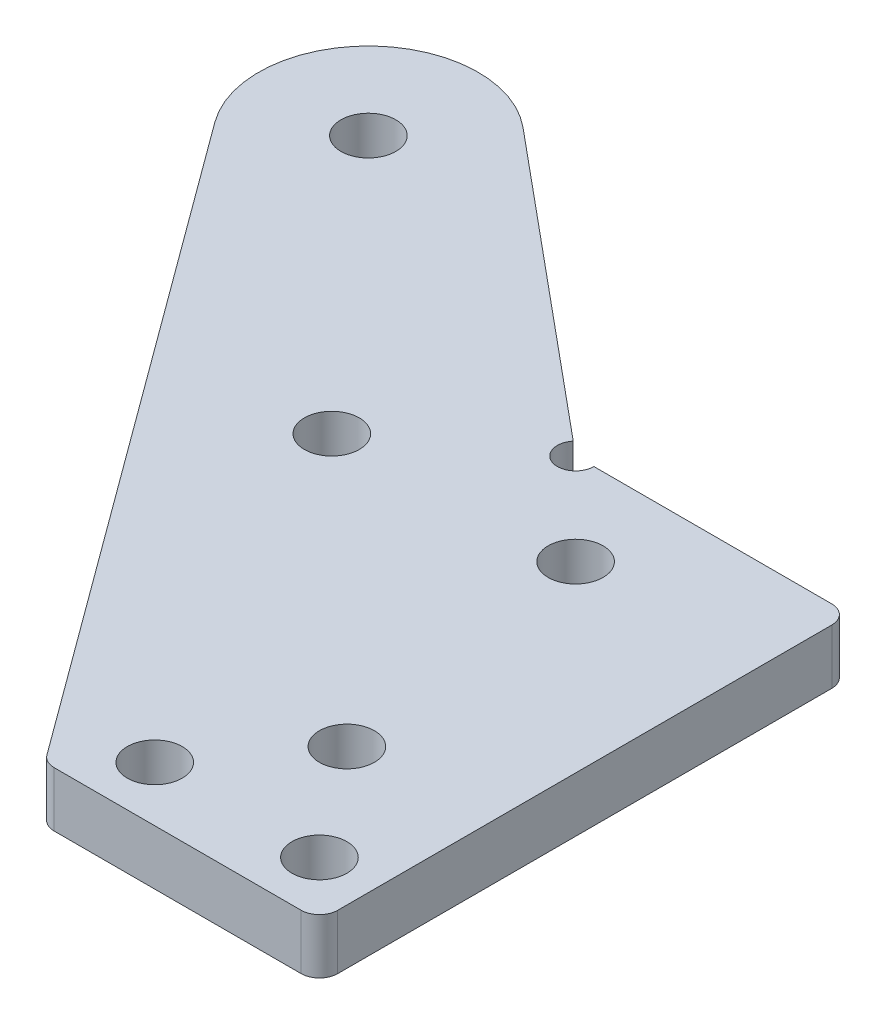
from build123d import *

# Parameters (mm, degrees)
SKETCH1_R           = 1.5
BOSS_EXTRUDE1_DEPTH = 3
FILLET1_R           = 1


with BuildPart() as part:
    # Sketch1 → Boss-Extrude1 (new body)
    with BuildSketch(Plane(origin=(0, 0, 0), x_dir=(1, 0, 0), z_dir=(0, 1, 0))):
        with BuildLine():
            Line((-16.991031726, 28.61519926), (-0.769199877, 15.139008255))
            ThreePointArc((-0.769199877, 15.139008255), (-0.339705846, 13.559468268), (1, 14.5))
            Line((1, 14.5), (15, 14.5))
            Line((15, 14.5), (15, -14.5))
            Line((15, -14.5), (0, -14.5))
            Line((0, -14.5), (-25.661386977, 20.448923126))
            ThreePointArc((-25.661386977, 20.448923126), (-24.938856388, 28.367705823), (-16.991031726, 28.61519926))
        make_face()
        with Locations(Location((-20.825081255, 24, 0), (0, 0, 270))):
            Circle(SKETCH1_R, mode=Mode.SUBTRACT)
        with Locations(Location((3, -11.5, 0), (0, 0, 270))):
            Circle(SKETCH1_R, mode=Mode.SUBTRACT)
        with Locations(Location((12, -11.5, 0), (0, 0, 270))):
            Circle(SKETCH1_R, mode=Mode.SUBTRACT)
        with Locations(Location((7.5, -5.5, 0), (0, 0, 270))):
            Circle(SKETCH1_R, mode=Mode.SUBTRACT)
        with Locations(Location((5, 9.5, 0), (0, 0, 270))):
            Circle(SKETCH1_R, mode=Mode.SUBTRACT)
        with Locations(Location((-7.71745767, 8.89403416, 0), (0, 0, 270))):
            Circle(SKETCH1_R, mode=Mode.SUBTRACT)
    extrude(amount=BOSS_EXTRUDE1_DEPTH)

    # Fillet1
    fillet1_edges = [part.edges().sort_by_distance(p)[0] for p in [
        (15, 1.5, -14.5),
        (15, 1.5, 14.5),
        (0, 1.5, 14.5),
    ]]
    fillet(fillet1_edges, radius=FILLET1_R)


solid = part.part
